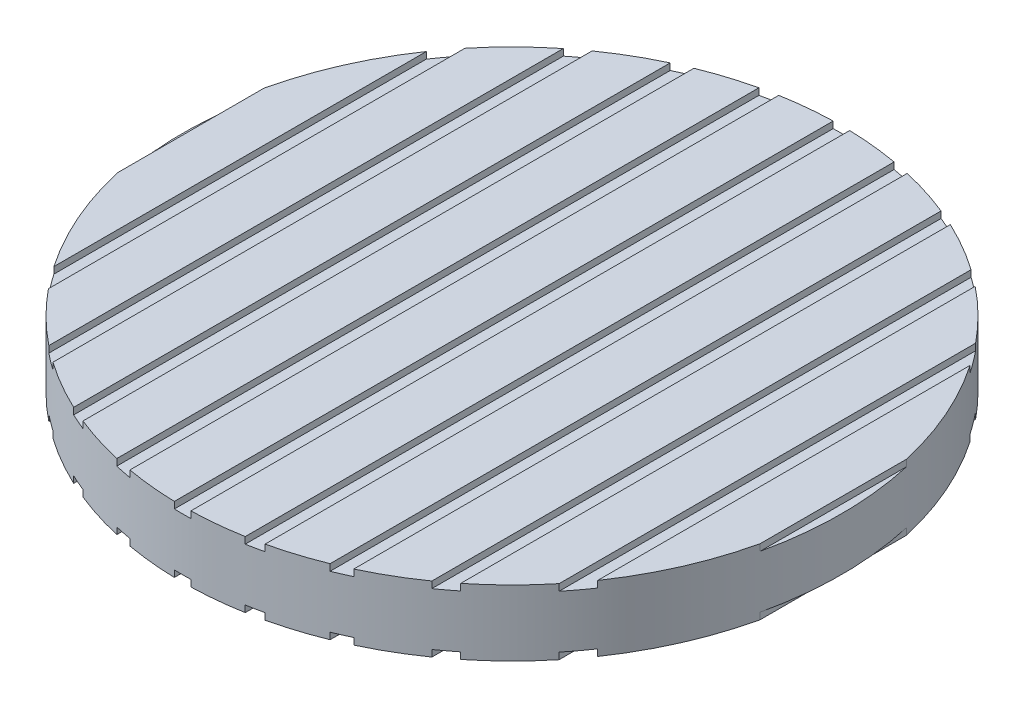
from build123d import *

# Parameters (mm, degrees)
SKETCH1_R           = 5
BOSS_EXTRUDE1_DEPTH = 1
SKETCH2_W           = 0.25
SKETCH2_H           = 10
CUT_EXTRUDE1_DEPTH  = 0.1


with BuildPart() as part:
    # Sketch1 → Boss-Extrude1 (new body)
    with BuildSketch(Plane(origin=(0, 0, 0), x_dir=(1, 0, 0), z_dir=(0, 1, 0))):
        with Locations(Location((-5.348238854, -2.10463103, 0), (0, 0, 270))):
            Circle(SKETCH1_R)
    extrude(amount=BOSS_EXTRUDE1_DEPTH)

    # Sketch2 → Cut-Extrude1 (cut)
    with BuildSketch(Plane(origin=(0, 1, 0), x_dir=(1, 0, 0), z_dir=(0, 1, 0))):
        with Locations((-10.348238854, -2.10463103)):
            Rectangle(SKETCH2_W, SKETCH2_H)
        with Locations((-11.348238854, -2.10463103)):
            Rectangle(SKETCH2_W, SKETCH2_H)
        with Locations((-9.348238854, -2.10463103)):
            Rectangle(SKETCH2_W, SKETCH2_H)
        with Locations((-8.348238854, -2.10463103)):
            Rectangle(SKETCH2_W, SKETCH2_H)
        with Locations((-7.348238854, -2.10463103)):
            Rectangle(SKETCH2_W, SKETCH2_H)
        with Locations((-6.348238854, -2.10463103)):
            Rectangle(SKETCH2_W, SKETCH2_H)
        with Locations((-5.348238854, -2.10463103)):
            Rectangle(SKETCH2_W, SKETCH2_H)
        with Locations((-4.348238854, -2.10463103)):
            Rectangle(SKETCH2_W, SKETCH2_H)
        with Locations((-3.348238854, -2.10463103)):
            Rectangle(SKETCH2_W, SKETCH2_H)
        with Locations((-2.348238854, -2.10463103)):
            Rectangle(SKETCH2_W, SKETCH2_H)
        with Locations((-1.348238854, -2.10463103)):
            Rectangle(SKETCH2_W, SKETCH2_H)
        with Locations((-0.348238854, -2.10463103)):
            Rectangle(SKETCH2_W, SKETCH2_H)
        with Locations((0.651761146, -2.10463103)):
            Rectangle(SKETCH2_W, SKETCH2_H)
        with Locations((1.651761146, -2.10463103)):
            Rectangle(SKETCH2_W, SKETCH2_H)
        with Locations((2.651761146, -2.10463103)):
            Rectangle(SKETCH2_W, SKETCH2_H)
    cut_extrude1 = extrude(amount=-CUT_EXTRUDE1_DEPTH, mode=Mode.SUBTRACT)

    # Mirror1: Cut-Extrude1 across plane
    add(cut_extrude1.mirror(Plane(origin=(0, 0.5, 0), x_dir=(0, 0, 1), z_dir=(0, -1, 0))), mode=Mode.SUBTRACT)


solid = part.part
